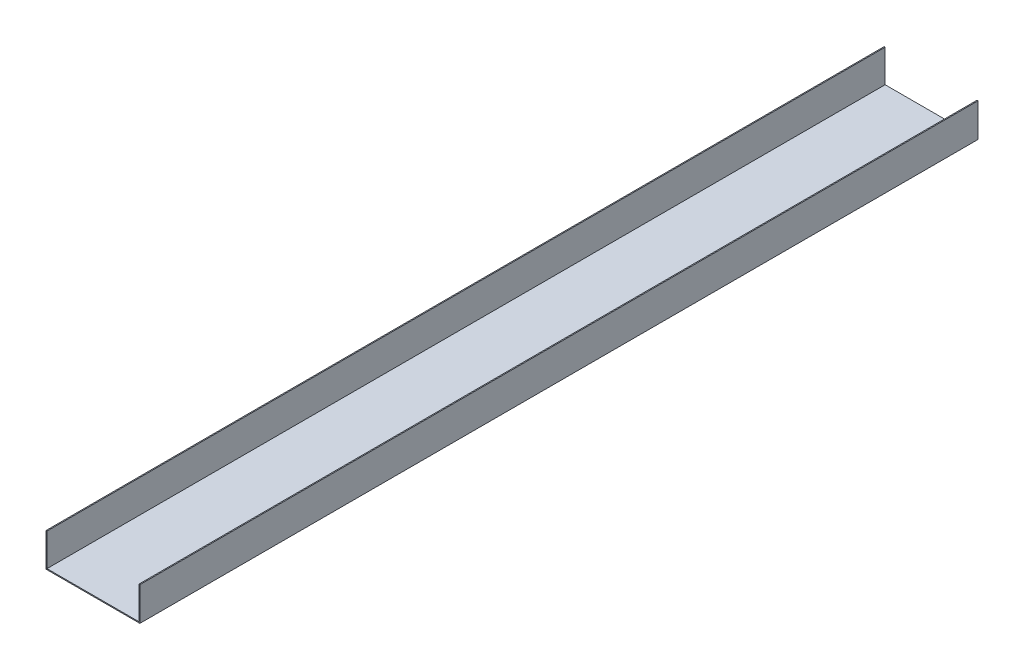
from build123d import *

# Parameters (mm, degrees)
EXTRUDE_2_DEPTH = 1250


with BuildPart() as part:
    # Эскиз1 → Бобышка-Вытянуть2 (new body)
    with BuildSketch(Plane.XY):
        Polygon((-70, -1.5), (70, -1.5), (70, 48.5), (68.5, 48.5), (68.5, 0), (-68.5, 0), (-68.5, 48.5), (-70, 48.5), align=None)
    extrude(amount=EXTRUDE_2_DEPTH)


solid = part.part
